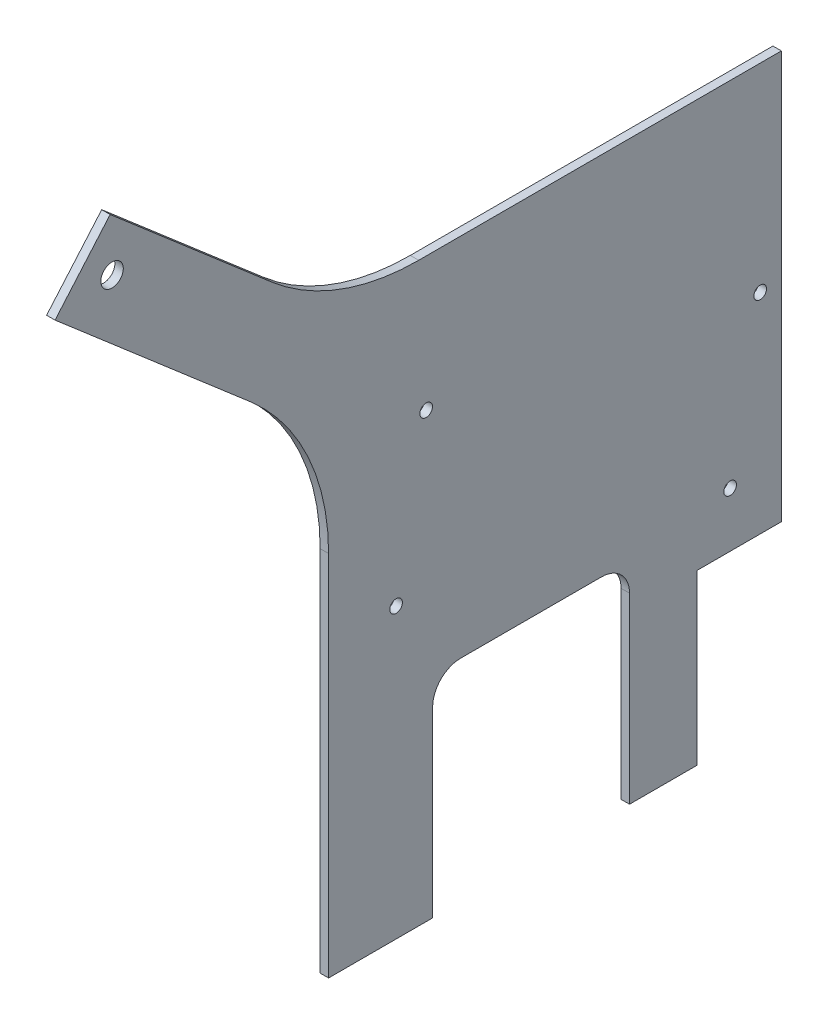
from build123d import *

# Parameters (mm, degrees)
SKETCH_1_R             = 4
EXTRUDE_1_DEPTH        = 1.5
CUT_EXTRUDE_1_DEPTH    = 318.767533759
HOLE_WIZARD_M4_1_D     = 4.5
HOLE_WIZARD_M4_1_DEPTH = 4
HOLE_WIZARD_M4_1_TIP   = 1.351936393
SKETCH_5_W             = 30
SKETCH_5_H             = 60
CUT_EXTRUDE_2_DEPTH    = 318.767533759


with BuildPart() as part:
    # 草图1 → 凸台-拉伸1 (new, symmetric)
    with BuildSketch(Plane(origin=(0, 0, 0), x_dir=(0, 0, -1), z_dir=(1, 0, 0))):
        with BuildLine():
            Line((-27.769667841, 191.317400645), (-97.269946411, 251.221762497))
            Line((-97.269946411, 251.221762497), (-77.683571852, 273.9456251))
            Line((-77.683571852, 273.9456251), (-20.204886802, 224.403033058))
            ThreePointArc((-20.204886802, 224.403033058), (4.166491279, 210.007475855), (32.025445357, 205))
            Line((32.025445357, 205), (161, 205))
            Line((161, 205), (161, 0))
            Line((161, 0), (0, 0))
            Line((0, 0), (0, 130.720433703))
            ThreePointArc((0, 130.720433703), (-7.273022293, 164.048900719), (-27.769667841, 191.317400645))
        make_face()
        with Locations((-77, 255)):
            Circle(SKETCH_1_R, mode=Mode.SUBTRACT)
    extrude(amount=EXTRUDE_1_DEPTH, both=True)

    # 草图2 → 切除-拉伸1 (cut, through all)
    with BuildSketch(Plane(origin=(1.5, 0, 0), x_dir=(0, 0, -1), z_dir=(1, 0, 0))):
        with BuildLine():
            Line((37, 0), (107, 0))
            Line((107, 0), (107, 65))
            ThreePointArc((107, 65), (104.071067812, 72.071067812), (97, 75))
            Line((97, 75), (47, 75))
            ThreePointArc((47, 75), (39.928932188, 72.071067812), (37, 65))
            Line((37, 65), (37, 0))
        make_face()
    extrude(amount=-CUT_EXTRUDE_1_DEPTH, mode=Mode.SUBTRACT)

    # M4 间隙孔1
    with Locations(Plane(origin=(1.5, 0, 0), x_dir=(0, 0, -1), z_dir=(1, 0, 0))):
        with Locations((34.69, 157.500209205), (24, 102.53), (153.464916317, 134.40217349), (142.774916317, 79.431964286)):
            Hole(HOLE_WIZARD_M4_1_D / 2, depth=HOLE_WIZARD_M4_1_DEPTH)
            with Locations((0, 0, -(HOLE_WIZARD_M4_1_DEPTH + HOLE_WIZARD_M4_1_TIP / 2))):  # 118° drill point
                Cone(0, HOLE_WIZARD_M4_1_D / 2, HOLE_WIZARD_M4_1_TIP, mode=Mode.SUBTRACT)

    # 草图5 → 切除-拉伸2 (cut, through all)
    with BuildSketch(Plane(origin=(1.5, 0, 0), x_dir=(0, 0, -1), z_dir=(1, 0, 0))):
        with Locations((146, 30)):
            Rectangle(SKETCH_5_W, SKETCH_5_H)
    extrude(amount=-CUT_EXTRUDE_2_DEPTH, mode=Mode.SUBTRACT)


solid = part.part
